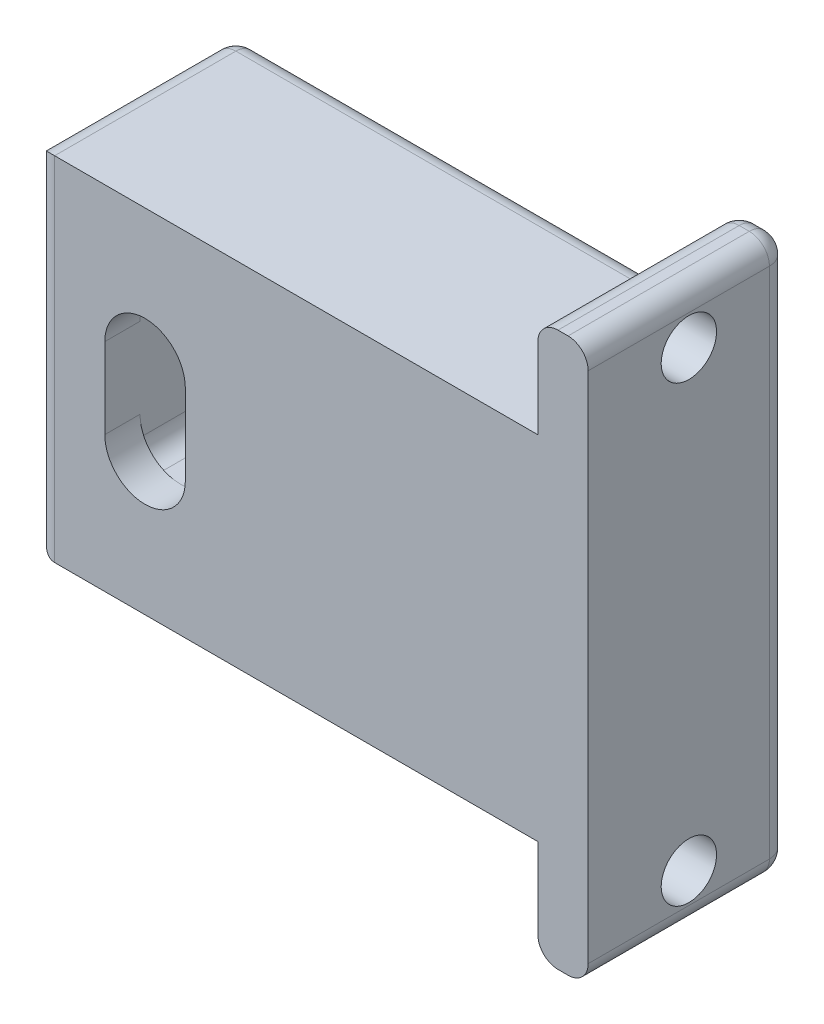
from build123d import *

# Parameters (mm, degrees)
SKETCH1_W           = 20
SKETCH1_H           = 35
BOSS_EXTRUDE1_DEPTH = 50
SKETCH2_W           = 20
SKETCH2_H           = 55
BOSS_EXTRUDE2_DEPTH = 5
SKETCH3_W           = 27
SKETCH3_H           = 16
CUT_EXTRUDE1_DEPTH  = 16.5
CUT_EXTRUDE2_DEPTH  = 16.5
SKETCH5_R           = 2.75
CUT_EXTRUDE3_DEPTH  = 71.178344238
FILLET1_R           = 2


with BuildPart() as part:
    # Sketch1 → Boss-Extrude1 (new body)
    with BuildSketch(Plane(origin=(0, 0, 0), x_dir=(0, 0, -1), z_dir=(1, 0, 0))):
        with Locations((-10, 17.5)):
            Rectangle(SKETCH1_W, SKETCH1_H)
    extrude(amount=BOSS_EXTRUDE1_DEPTH)

    # Sketch2 → Boss-Extrude2 (add)
    with BuildSketch(Plane(origin=(50, 0, 0), x_dir=(0, 0, -1), z_dir=(1, 0, 0))):
        with Locations((-10, 17.5)):
            Rectangle(SKETCH2_W, SKETCH2_H)
    extrude(amount=BOSS_EXTRUDE2_DEPTH)

    # Sketch3 → Cut-Extrude1 (cut)
    with BuildSketch(Plane(origin=(0, 0, 0), x_dir=(-1, 0, 0), z_dir=(0, 0, -1))):
        with Locations((-20.480792353, 17.5)):
            Rectangle(SKETCH3_W, SKETCH3_H)
    extrude(amount=-CUT_EXTRUDE1_DEPTH, mode=Mode.SUBTRACT)

    # Sketch4 → Cut-Extrude2 (cut)
    with BuildSketch(Plane(origin=(0, 0, 16.5), x_dir=(-1, 0, 0), z_dir=(0, 0, -1))):
        with BuildLine():
            Line((-6.980792353, 21.5), (-6.980792353, 13.5))
            ThreePointArc((-6.980792353, 13.5), (-10.980792353, 9.5), (-14.980792353, 13.5))
            Line((-14.980792353, 13.5), (-14.980792353, 21.5))
            ThreePointArc((-14.980792353, 21.5), (-10.980792353, 25.5), (-6.980792353, 21.5))
        make_face()
    extrude(amount=-CUT_EXTRUDE2_DEPTH, mode=Mode.SUBTRACT)

    # Sketch5 → Cut-Extrude3 (cut, through all)
    with BuildSketch(Plane.ZY.offset(-50)):
        with Locations((10, 40)):
            Circle(SKETCH5_R)
        with Locations((10, -5)):
            Circle(SKETCH5_R)
    extrude(amount=-CUT_EXTRUDE3_DEPTH, mode=Mode.SUBTRACT)

    # Fillet1
    fillet1_edges = [part.edges().sort_by_distance(p)[0] for p in [
        (50, -10, 10),
        (50, -5, 0),
        (50, 40, 0),
        (52.5, -10, 0),
        (50, 45, 10),
        (52.5, 45, 0),
        (55, -10, 10),
        (55, 17.5, 0),
        (55, 45, 10),
        (33.980792353, 9.5, 8.25),
        (33.980792353, 25.5, 8.25),
        (6.980792353, 25.5, 8.25),
        (6.980792353, 9.5, 8.25),
        (33.980792353, 17.5, 0),
        (20.480792353, 9.5, 0),
        (6.980792353, 17.5, 0),
        (20.480792353, 25.5, 0),
        (0, 35, 10),
        (0, 17.5, 0),
        (0, 0, 10),
        (0, 17.5, 20),
        (25, 35, 0),
        (25, 0, 0),
    ]]
    fillet(fillet1_edges, radius=FILLET1_R)


solid = part.part
